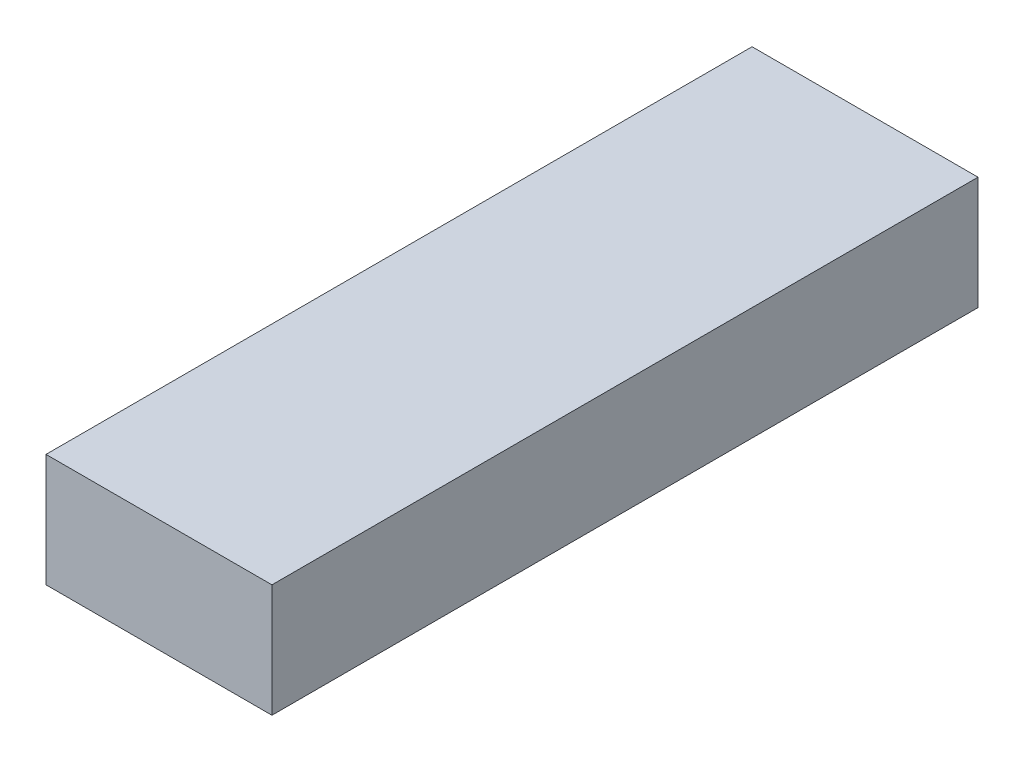
from build123d import *

# Parameters (mm, degrees)
SKETCH1_W           = 101.6
SKETCH1_H           = 50.8
BOSS_EXTRUDE1_DEPTH = 317.5


with BuildPart() as part:
    # Sketch1 → Boss-Extrude1 (new body)
    with BuildSketch(Plane.XY):
        Rectangle(SKETCH1_W, SKETCH1_H)
    extrude(amount=BOSS_EXTRUDE1_DEPTH)


solid = part.part
